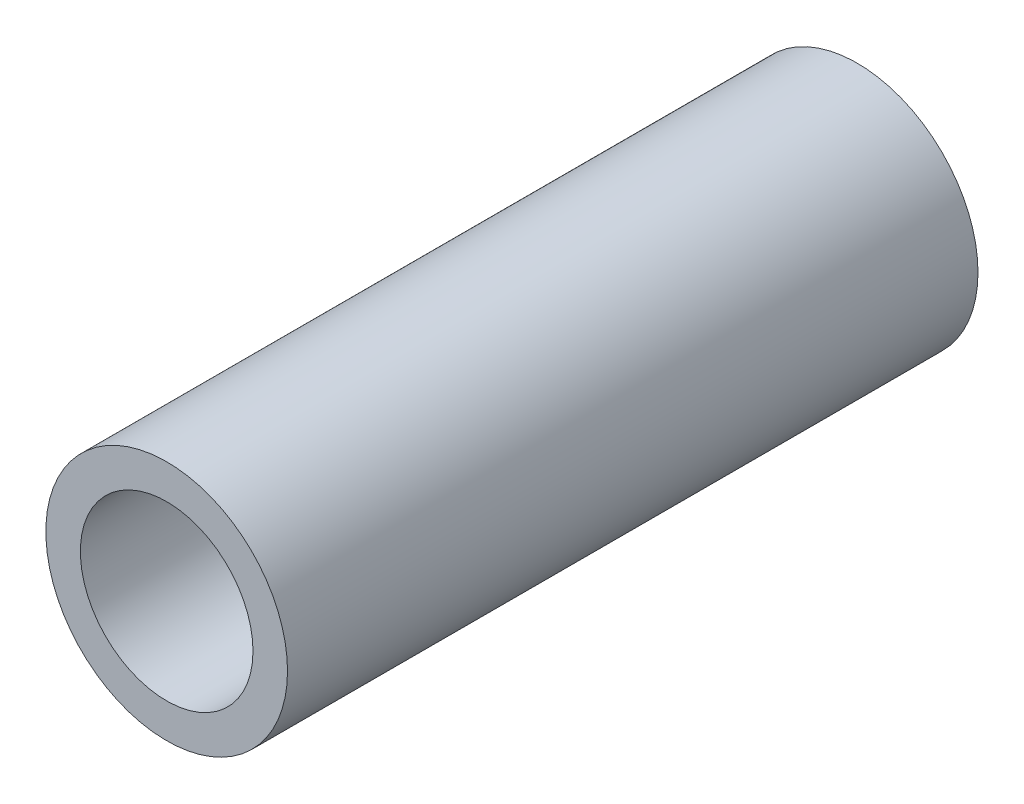
from build123d import *

# Parameters (mm, degrees)
IZIM1_R                     = 10.5
IZIM1_R_2                   = 7.5
Y_KSEKLIK_EKSTR_ZYON1_DEPTH = 30


with BuildPart() as part:
    # Çizim1 → Yükseklik-Ekstrüzyon1 (new, symmetric)
    with BuildSketch(Plane.XY):
        Circle(IZIM1_R)
        Circle(IZIM1_R_2, mode=Mode.SUBTRACT)
    extrude(amount=Y_KSEKLIK_EKSTR_ZYON1_DEPTH, both=True)


solid = part.part
